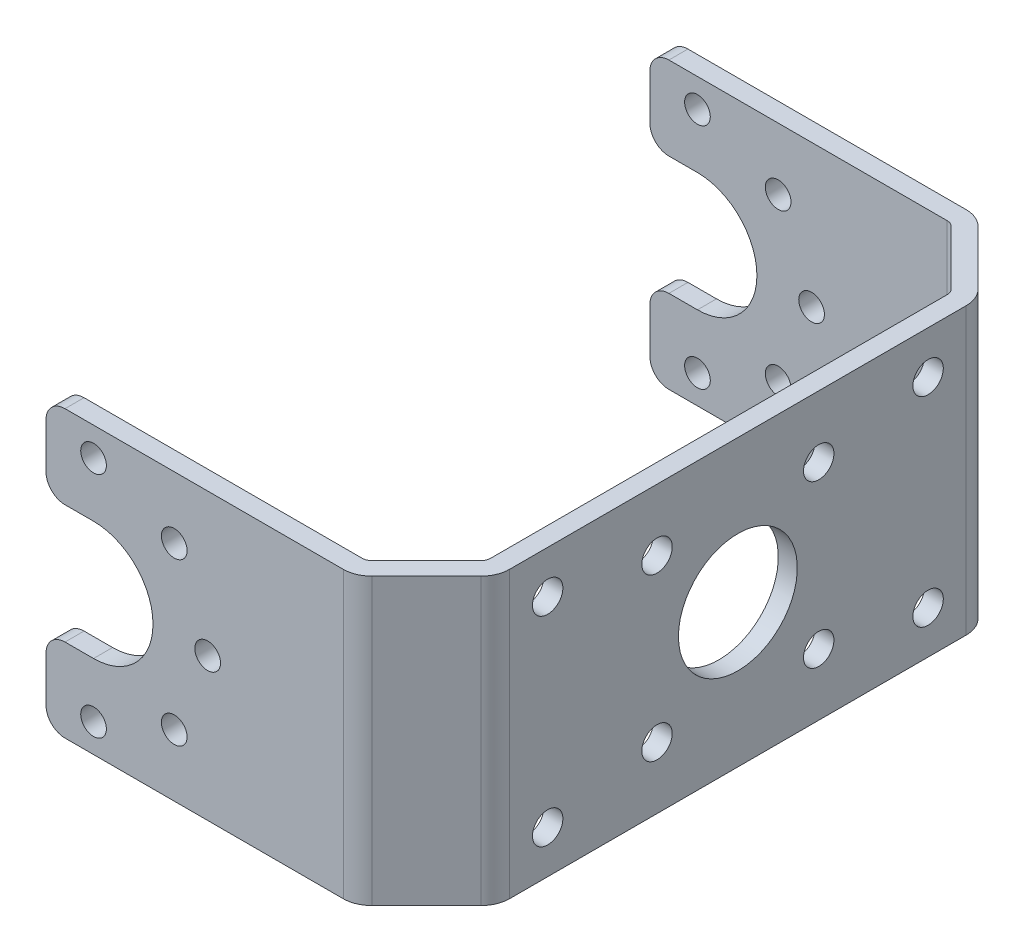
from build123d import *

# Parameters (mm, degrees)
EXTRUDE_1_DEPTH     = 15
SKETCH_2_R          = 1.6
SKETCH_2_R_2        = 6.25
CUT_EXTRUDE_1_DEPTH = 2
SKETCH_3_R          = 1.35
CUT_EXTRUDE_2_DEPTH = 37
FILLET_1_R          = 2
FILLET_2_R          = 1
FILLET_3_R          = 3


with BuildPart() as part:
    # 草图1 → 凸台-拉伸1 (new, symmetric)
    with BuildSketch(Plane(origin=(0, 0, 0), x_dir=(1, 0, 0), z_dir=(0, 1, 0))):
        Polygon((0, 0), (0, 25.248427125), (-7.501572875, 32.75), (-40, 32.75), (-40, 30.75), (-8.33, 30.75), (-2, 24.42), (-2, 0), (-2, -24.42), (-8.33, -30.75), (-40, -30.75), (-40, -32.75), (-7.501572875, -32.75), (0, -25.248427125), align=None)
    extrude(amount=EXTRUDE_1_DEPTH, both=True)

    # 草图2 → 切除-拉伸1 (cut)
    with BuildSketch(Plane.ZY.offset(2)):
        with Locations((-20, 10.5)):
            Circle(SKETCH_2_R)
        with Locations((-8.5, 8.5)):
            Circle(SKETCH_2_R)
        with Locations((8.5, 8.5)):
            Circle(SKETCH_2_R)
        with Locations((20, 10.5)):
            Circle(SKETCH_2_R)
        with Locations((20, -10.5)):
            Circle(SKETCH_2_R)
        with Locations((8.5, -8.5)):
            Circle(SKETCH_2_R)
        with Locations((-8.5, -8.5)):
            Circle(SKETCH_2_R)
        with Locations((-20, -10.5)):
            Circle(SKETCH_2_R)
        Circle(SKETCH_2_R_2)
    extrude(amount=-CUT_EXTRUDE_1_DEPTH, mode=Mode.SUBTRACT)

    # 草图3 → 切除-拉伸2 (cut, symmetric)
    with BuildSketch(Plane.XY):
        with Locations((-23, 0)):
            Circle(SKETCH_3_R)
        with Locations((-26.514718626, -8.485281374)):
            Circle(SKETCH_3_R)
        with Locations((-35, -12)):
            Circle(SKETCH_3_R)
        with Locations((-35, 12)):
            Circle(SKETCH_3_R)
        with Locations((-26.514718626, 8.485281374)):
            Circle(SKETCH_3_R)
        with BuildLine():
            Line((-35, 6.25), (-40, 6.25))
            Line((-40, 6.25), (-40, -6.25))
            Line((-40, -6.25), (-35, -6.25))
            ThreePointArc((-35, -6.25), (-28.75, 0), (-35, 6.25))
        make_face()
    extrude(amount=CUT_EXTRUDE_2_DEPTH, both=True, mode=Mode.SUBTRACT)

    # 圆角1
    fillet_1_edges = [part.edges().sort_by_distance(p)[0] for p in [
        (-40, -6.25, -31.75),
        (-40, -6.25, 31.75),
        (-40, 6.25, -31.75),
        (-40, 6.25, 31.75),
        (-40, -15, 31.75),
        (-40, -15, -31.75),
        (-40, 15, -31.75),
        (-40, 15, 31.75),
    ]]
    fillet(fillet_1_edges, radius=FILLET_1_R)

    # 圆角2
    fillet_2_edges = [part.edges().sort_by_distance(p)[0] for p in [
        (-8.33, 0, 30.75),
        (-2, 0, 24.42),
        (-2, 0, -24.42),
        (-8.33, 0, -30.75),
    ]]
    fillet(fillet_2_edges, radius=FILLET_2_R)

    # 圆角3
    fillet_3_edges = [part.edges().sort_by_distance(p)[0] for p in [
        (0, 0, 25.248427125),
        (-7.501572875, 0, 32.75),
        (-7.501572875, 0, -32.75),
        (0, 0, -25.248427125),
    ]]
    fillet(fillet_3_edges, radius=FILLET_3_R)


solid = part.part
